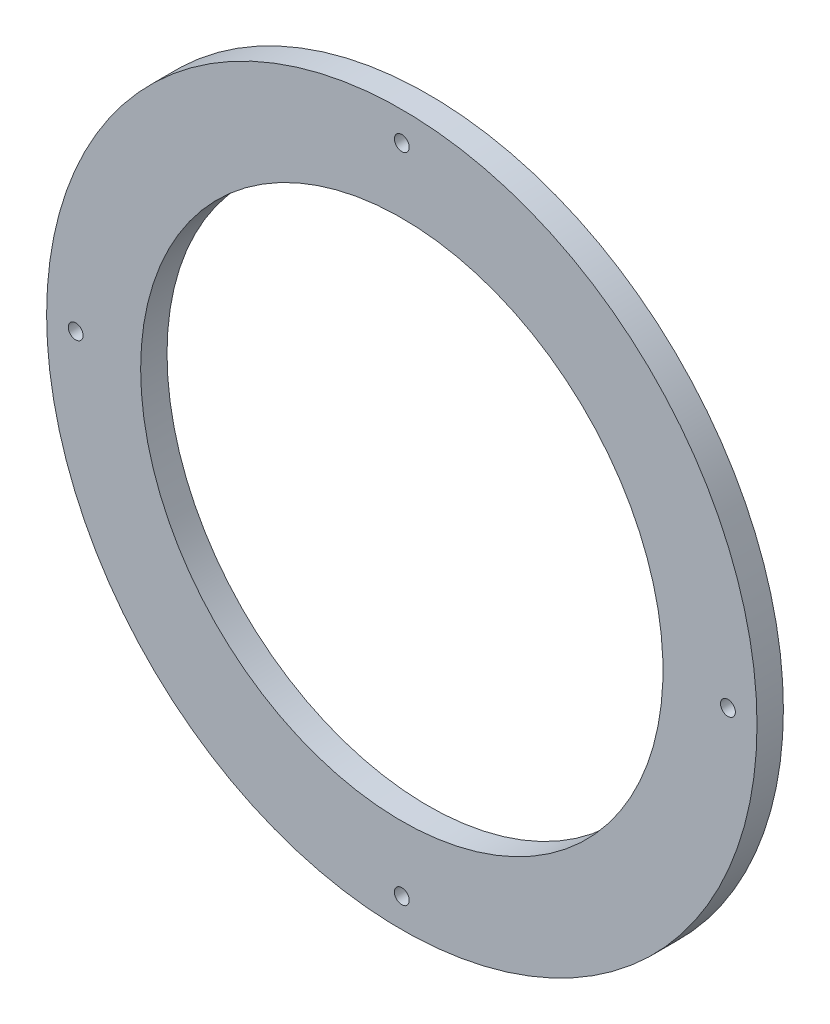
from build123d import *

# Parameters (mm, degrees)
SKETCH1_R           = 85.5
SKETCH1_R_2         = 1.7859375
BOSS_EXTRUDE1_DEPTH = 6.35
SKETCH7_R           = 62.865
CUT_EXTRUDE4_DEPTH  = 122.081883451


with BuildPart() as part:
    # Sketch1 → Boss-Extrude1 (new body)
    with BuildSketch(Plane.XY):
        Circle(SKETCH1_R)
        with Locations((0, 78.499999972)):
            Circle(SKETCH1_R_2, mode=Mode.SUBTRACT)
        with Locations((78.5, 0)):
            Circle(SKETCH1_R_2, mode=Mode.SUBTRACT)
        with Locations((2.8e-08, -78.5)):
            Circle(SKETCH1_R_2, mode=Mode.SUBTRACT)
        with Locations((-78.499999972, -2.8e-08)):
            Circle(SKETCH1_R_2, mode=Mode.SUBTRACT)
    extrude(amount=BOSS_EXTRUDE1_DEPTH)

    # Sketch7 → Cut-Extrude4 (cut, through all)
    with BuildSketch(Plane(origin=(0, 0, 0), x_dir=(-1, 0, 0), z_dir=(0, 0, -1))):
        Circle(SKETCH7_R)
    extrude(amount=-CUT_EXTRUDE4_DEPTH, mode=Mode.SUBTRACT)


solid = part.part
